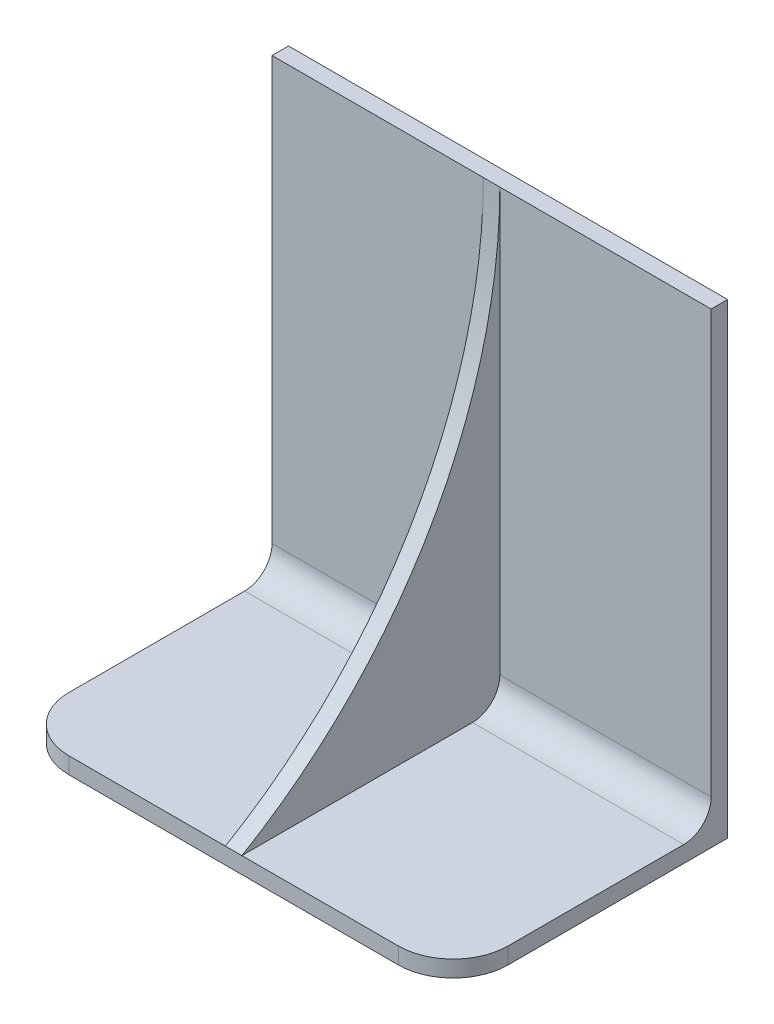
from build123d import *

# Parameters (mm, degrees)
SKETCH1_W           = 80
SKETCH1_H           = 50
BOSS_EXTRUDE1_DEPTH = 3
SKETCH2_W           = 80
SKETCH2_H           = 3
BOSS_EXTRUDE2_DEPTH = 82
BOSS_EXTRUDE3_DEPTH = 1.5
FILLET1_R           = 10
FILLET2_R           = 5


with BuildPart() as part:
    # Sketch1 → Boss-Extrude1 (new body)
    with BuildSketch(Plane(origin=(0, 0, 0), x_dir=(1, 0, 0), z_dir=(0, 1, 0))):
        Rectangle(SKETCH1_W, SKETCH1_H)
    extrude(amount=BOSS_EXTRUDE1_DEPTH)

    # Sketch2 → Boss-Extrude2 (add)
    with BuildSketch(Plane(origin=(0, 3, 0), x_dir=(1, 0, 0), z_dir=(0, 1, 0))):
        with Locations((0, 23.5)):
            Rectangle(SKETCH2_W, SKETCH2_H)
    extrude(amount=BOSS_EXTRUDE2_DEPTH)

    # Sketch3 → Boss-Extrude3 (add, symmetric)
    with BuildSketch(Plane(origin=(0, 0, 0), x_dir=(0, 0, -1), z_dir=(1, 0, 0))):
        with BuildLine():
            Line((22, 85), (22, 3))
            Line((22, 3), (-25, 3))
            ThreePointArc((-25, 3), (9.416947126, 37.742725428), (22, 85))
        make_face()
    extrude(amount=BOSS_EXTRUDE3_DEPTH, both=True)

    # Fillet1
    fillet1_edges = [part.edges().sort_by_distance(p)[0] for p in [
        (40, 1.5, 25),
        (-40, 1.5, 25),
    ]]
    fillet(fillet1_edges, radius=FILLET1_R)

    # Fillet2
    fillet2_edges = [part.edges().sort_by_distance(p)[0] for p in [
        (-20.75, 3, -22),
        (20.75, 3, -22),
    ]]
    fillet(fillet2_edges, radius=FILLET2_R)


solid = part.part
